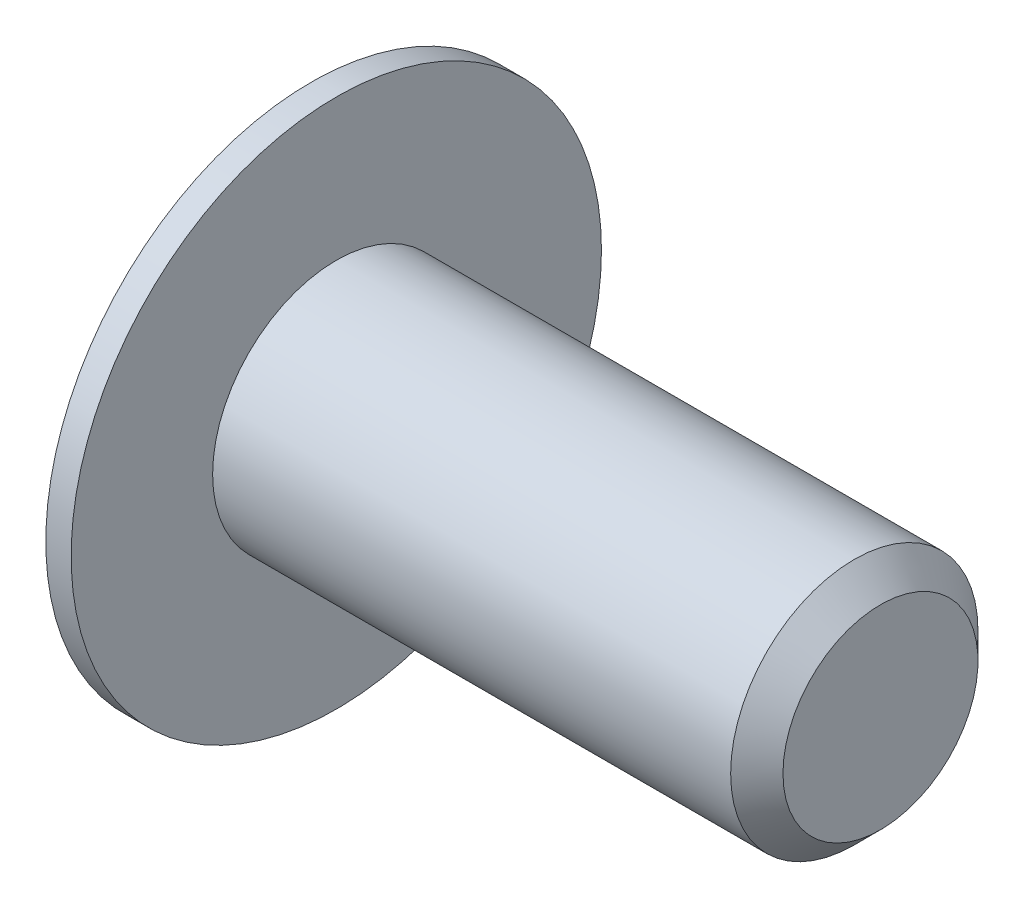
from build123d import *

# Parameters (mm, degrees)
SKETCH2_R           = 3.96875
BOSS_EXTRUDE1_DEPTH = 17.4625
CUT_EXTRUDE1_DEPTH  = 3.556
CHAMFER1_SIZE       = 0.83947


with BuildPart() as part:
    # Sketch1 → Revolve1 (revolve)
    with BuildSketch(Plane.XY, mode=Mode.PRIVATE) as revolve1_sk:
        with BuildLine():
            Line((-4.064, 2.8956), (-4.064, 0))
            Line((-4.064, 0), (0, 0))
            Line((0, 0), (0, 8.509))
            Line((0, 8.509), (-0.8128, 8.509))
            Line((-0.8128, 8.509), (-0.8128, 7.6581))
            ThreePointArc((-0.8128, 7.6581), (-2.854131619, 5.560656119), (-4.064, 2.8956))
        make_face()
    revolve(revolve1_sk.sketch.rotate(Axis((-4.064, 0, 0), (1, 0, 0)), 270), axis=Axis((-4.064, 0, 0), (1, 0, 0)))

    # Sketch2 → Boss-Extrude1 (add)
    with BuildSketch(Plane(origin=(0, 0, 0), x_dir=(0, 0, -1), z_dir=(1, 0, 0))):
        Circle(SKETCH2_R)
    extrude(amount=BOSS_EXTRUDE1_DEPTH)

    # Sketch3 → Cut-Extrude1 (cut)
    with BuildSketch(Plane.ZY.offset(4.064)):
        Polygon((0, -2.786292399), (2.413, -1.3931462), (2.413, 1.3931462), (0, 2.786292399), (-2.413, 1.3931462), (-2.413, -1.3931462), align=None)
    extrude(amount=-CUT_EXTRUDE1_DEPTH, mode=Mode.SUBTRACT)

    # Chamfer1
    chamfer1_edges = [part.edges().sort_by_distance(p)[0] for p in [
        (17.4625, 0, 3.96875),
    ]]
    chamfer(chamfer1_edges, length=CHAMFER1_SIZE)


solid = part.part
